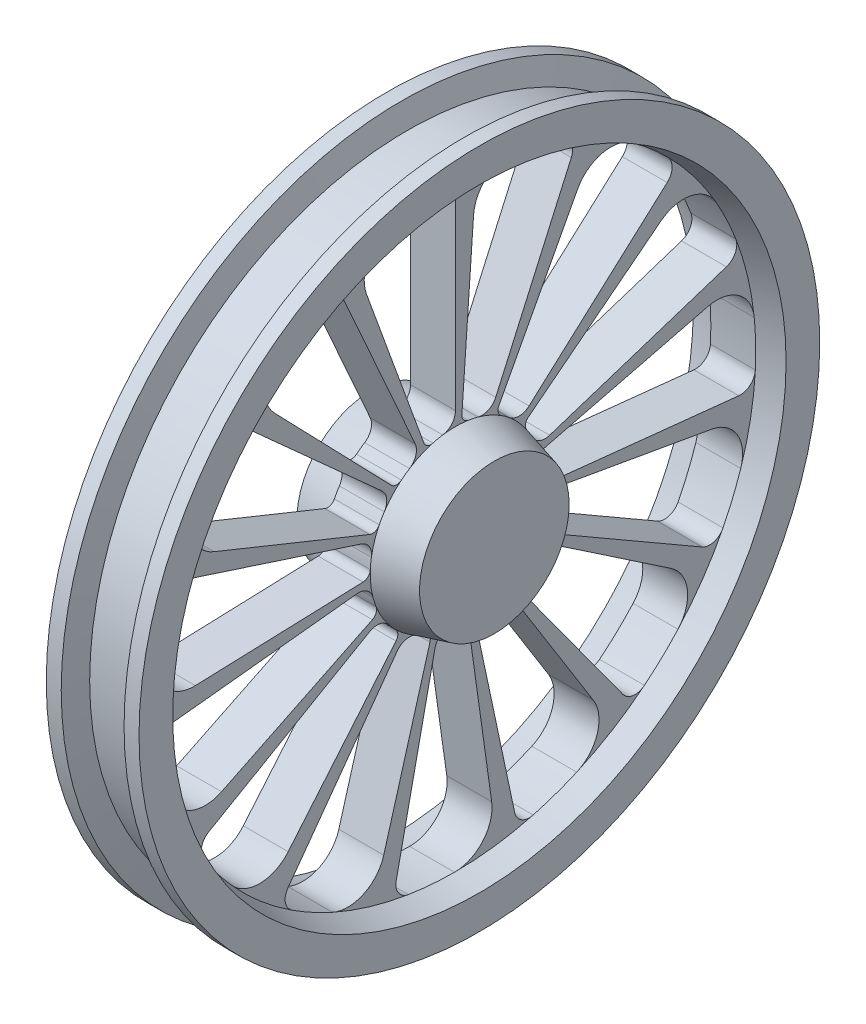
from build123d import *

# Parameters (mm, degrees)
ENL_V_MAT_EXTRU_1_DEPTH      = 654.141638544
R_P_TITION_CIRCULAIRE2_COUNT = 15


with BuildPart() as part:
    # Esquisse1 → Révolution1 (revolve)
    with BuildSketch(Plane(origin=(0, 0, 0), x_dir=(1, 0, 0), z_dir=(0, 1, 0))):
        Polygon((-60, 113.933358006), (-60, 401.425625842), (-92, 410), (-92, 455), (-72, 455), (-63.961524227, 425), (3.961524227, 425), (12, 455), (32, 455), (32, 410), (0, 401.425625842), (0, 113.933358006), (52, 100), (52, 0), (-112, 0), (-112, 100), align=None)
    revolve(axis=Axis((52, 0, 0), (-1, 0, 0)))

    # Esquisse2 → Enlèv. mat.-Extru.1 (cut, through all)
    with BuildSketch(Plane.ZY.offset(60)):
        with BuildLine():
            Line((118.971877939, 326.872548187), (42.249494034, 116.079530842))
            ThreePointArc((42.249494034, 116.079530842), (37.441245649, 110.614686646), (30.201742548, 109.857475001))
            ThreePointArc((30.201742548, 109.857475001), (23.649020488, 111.451935365), (17.013440072, 112.655904965))
            ThreePointArc((17.013440072, 112.655904965), (4.83868082, 119.388101483), (0, 132.431659307))
            Line((0, 132.431659307), (0, 380.900916314))
            ThreePointArc((0, 380.900916314), (6.233626925, 395.409085474), (21.048697237, 400.873403243))
            ThreePointArc((21.048697237, 400.873403243), (51.79221228, 398.070470934), (82.22942072, 392.913292535))
            ThreePointArc((82.22942072, 392.913292535), (115.680172839, 368.282570612), (118.971877939, 326.872548187))
        make_face()
    enl_v_mat_extru_1 = extrude(amount=-ENL_V_MAT_EXTRU_1_DEPTH, mode=Mode.SUBTRACT)

    # Répétition circulaire2: Enlèv. mat.-Extru.1 ×15 about axis
    r_p_tition_circulaire2_axis = Axis((0, 0, 0), (1, 0, 0))
    for i in range(1, R_P_TITION_CIRCULAIRE2_COUNT):
        add(enl_v_mat_extru_1.rotate(r_p_tition_circulaire2_axis, i * 360 / R_P_TITION_CIRCULAIRE2_COUNT), mode=Mode.SUBTRACT)


solid = part.part
